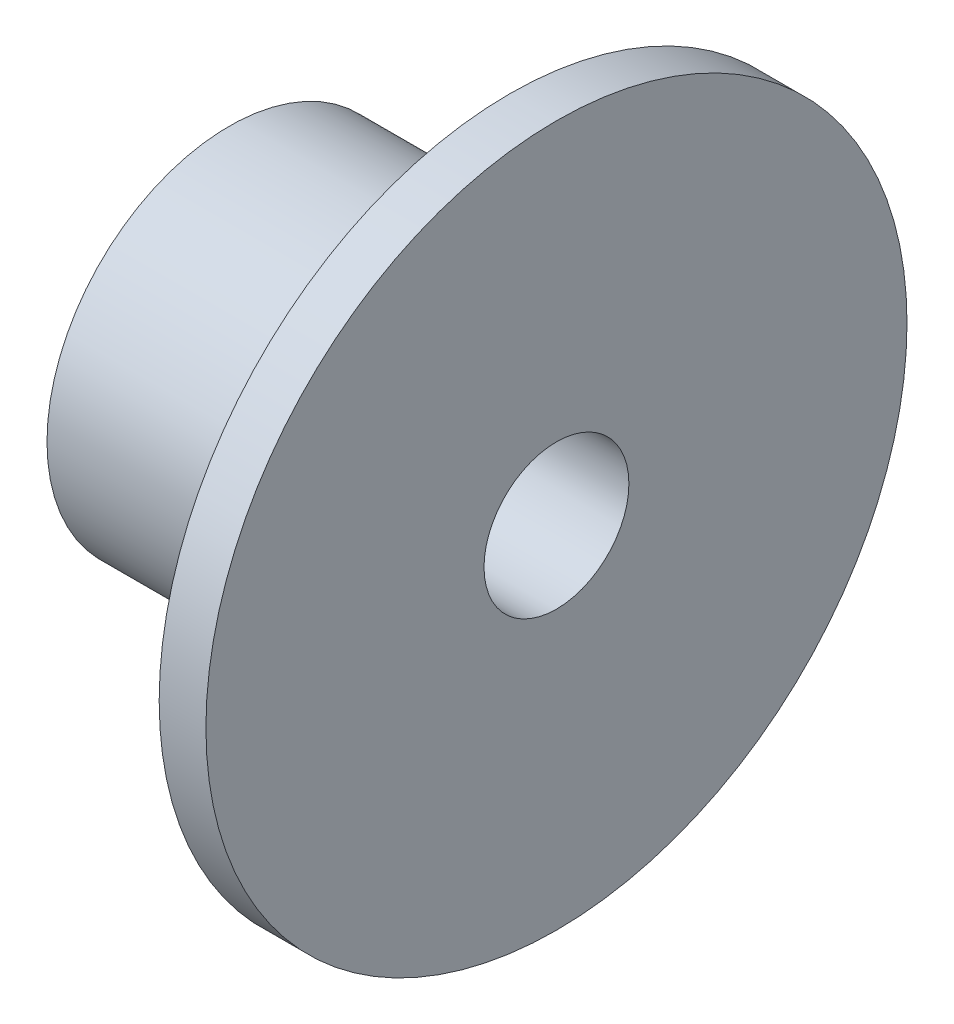
from build123d import *

# Parameters (mm, degrees)
ESBO_O1_R                = 3.9
ESBO_O1_R_2              = 1.55
RESSALTO_EXTRUS_O1_DEPTH = 6
ESBO_O2_R                = 7.5
ESBO_O2_R_2              = 1.55
RESSALTO_EXTRUS_O2_DEPTH = 1
CORTE_EXTRUS_O1_DEPTH    = 3
FILETE1_R                = 1


with BuildPart() as part:
    # Esboço1 → Ressalto-extrusão1 (new body)
    with BuildSketch(Plane(origin=(0, 0, 0), x_dir=(0, 0, -1), z_dir=(1, 0, 0))):
        Circle(ESBO_O1_R)
        Circle(ESBO_O1_R_2, mode=Mode.SUBTRACT)
    extrude(amount=RESSALTO_EXTRUS_O1_DEPTH)

    # Esboço2 → Ressalto-extrusão2 (add)
    with BuildSketch(Plane(origin=(6, 0, 0), x_dir=(0, 0, -1), z_dir=(1, 0, 0))):
        Circle(ESBO_O2_R)
        Circle(ESBO_O2_R_2, mode=Mode.SUBTRACT)
    extrude(amount=RESSALTO_EXTRUS_O2_DEPTH)

    # Esboço3 → Corte-extrusão1 (cut)
    with BuildSketch(Plane.ZY):
        Polygon((1.703183294, -2.95), (3.406366588, 0), (1.703183294, 2.95), (-1.703183294, 2.95), (-3.406366588, 0), (-1.703183294, -2.95), align=None)
    extrude(amount=-CORTE_EXTRUS_O1_DEPTH, mode=Mode.SUBTRACT)

    # Filete1
    filete1_edges = [part.edges().sort_by_distance(p)[0] for p in [
        (6, 0, 3.9),
    ]]
    fillet(filete1_edges, radius=FILETE1_R)


solid = part.part
